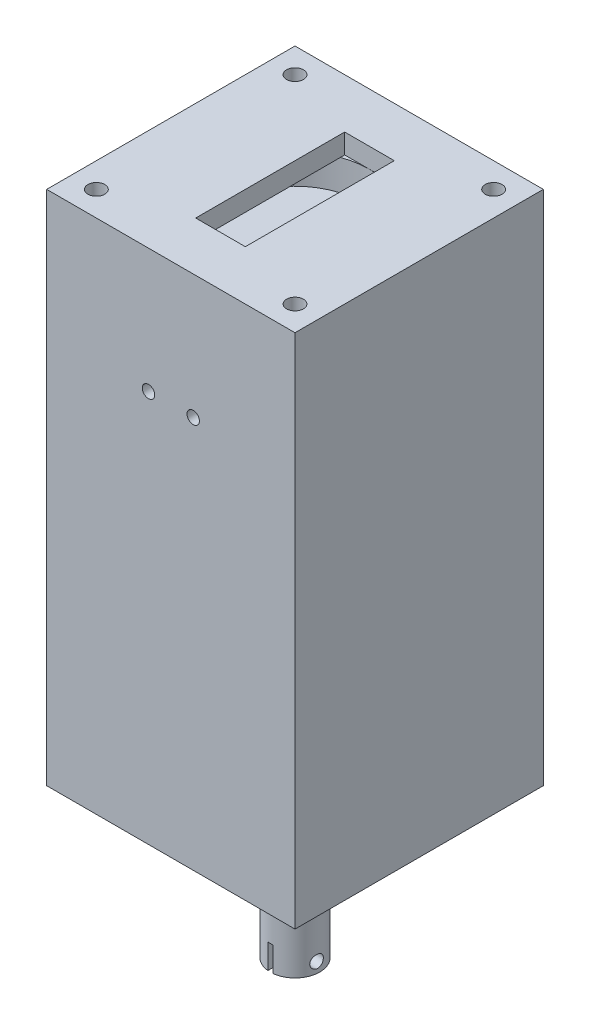
from build123d import *

# Parameters (mm, degrees)
SKETCH_1_W                         = 50
SKETCH_1_H                         = 50
EXTRUDE_1_DEPTH                    = 100
SKETCH_2_R                         = 15
CUT_EXTRUDE_1_DEPTH                = 80
EXTRUDE_START                      = 20
SKETCH_3_R                         = 15
EXTRUDE_2_DEPTH                    = 20
SKETCH_4_R                         = 5
CUT_EXTRUDE_3_DEPTH                = 107.066017178
SKETCH_13_R                        = 1
SKETCH_14_R                        = 13.5
EXTRUDE_4_DEPTH                    = 25
SKETCH_15_W                        = 50
SKETCH_15_H                        = 50
EXTRUDE_5_DEPTH                    = 4
HOLE_WIZARD_M3_1_AT_2_COUNT        = 2
HOLE_WIZARD_M3_1_AT_2_PITCH        = 40
HOLE_WIZARD_M3_1_AT_3_COUNT        = 2
HOLE_WIZARD_M3_1_AT_3_PITCH        = 40
HOLE_WIZARD_M3_1_AT_4_COUNT        = 2
HOLE_WIZARD_M3_1_AT_4_PITCH        = 56.568542495
SKETCH_17_W                        = 10
SKETCH_17_H                        = 30
CUT_EXTRUDE_4_DEPTH                = 4
EXTRUDE_START_2                    = 100
SKETCH_18_R                        = 5
EXTRUDE_6_DEPTH                    = 100
SKETCH_19_W                        = 1
SKETCH_19_H                        = 12
CUT_EXTRUDE_5_DEPTH                = 5
HOLE_WIZARD_M3_1_2_D               = 2.5
HOLE_WIZARD_M3_1_2_DEPTH           = 10
HOLE_WIZARD_M3_1_2_TIP             = 0.751075774
HOLE_WIZARD_M3_1_2_ON_FACE_2_D     = 2.5
HOLE_WIZARD_M3_1_2_ON_FACE_2_DEPTH = 10
HOLE_WIZARD_M3_1_2_ON_FACE_2_TIP   = 0.751075774
HOLE_WIZARD_M3_3_D                 = 2.5
HOLE_WIZARD_M3_3_DEPTH             = 4
HOLE_WIZARD_M3_3_TIP               = 0.751075774


with BuildPart() as part:
    # 草图1 → 凸台-拉伸1 (new body)
    with BuildSketch(Plane(origin=(0, 0, 0), x_dir=(1, 0, 0), z_dir=(0, 1, 0))):
        Rectangle(SKETCH_1_W, SKETCH_1_H)
    extrude(amount=EXTRUDE_1_DEPTH)

    # 草图2 → 切除-拉伸1 (cut)
    with BuildSketch(Plane(origin=(0, 100, 0), x_dir=(1, 0, 0), z_dir=(0, 1, 0))):
        with Locations(Location((0, 0, 0), (0, 0, 270))):
            Circle(SKETCH_2_R)
    extrude(amount=-CUT_EXTRUDE_1_DEPTH, mode=Mode.SUBTRACT)

    # 草图3 → 凸台-拉伸2 (add)
    with BuildSketch(Plane(origin=(0, 0, 0), x_dir=(1, 0, 0), z_dir=(0, 1, 0)).offset(EXTRUDE_START)):
        with Locations(Location((0, 0, 0), (0, 0, 270))):
            Circle(SKETCH_3_R)
    extrude(amount=-EXTRUDE_2_DEPTH)

    # 草图4 → 切除-拉伸3 (cut, through all)
    with BuildSketch(Plane(origin=(0, 0, 0), x_dir=(1, 0, 0), z_dir=(0, 1, 0))):
        with Locations(Location((0, 0, 0), (0, 0, 270))):
            Circle(SKETCH_4_R)
    extrude(amount=CUT_EXTRUDE_3_DEPTH, mode=Mode.SUBTRACT)

    # 扫描2: sweep along a curve in space
    with BuildLine() as sweep_2_path:
        add(Edge.make_bspline(
            [(-8.485281374, 20, -8.485281374), (-4.970562748, 20.75, -12), (0, 21.5, -12), (4.970562748, 22.25, -12), (8.485281374, 23, -8.485281374), (12, 23.75, -4.970562748), (12, 24.5, 0), (12, 25.25, 4.970562748), (8.485281374, 26, 8.485281374), (4.970562748, 26.75, 12), (0, 27.5, 12), (-4.970562748, 28.25, 12), (-8.485281374, 29, 8.485281374), (-12, 29.75, 4.970562748), (-12, 30.5, 0), (-12, 31.25, -4.970562748), (-8.485281374, 32, -8.485281374), (-4.970562748, 32.75, -12), (0, 33.5, -12), (4.970562748, 34.25, -12), (8.485281374, 35, -8.485281374), (12, 35.75, -4.970562748), (12, 36.5, 0), (12, 37.25, 4.970562748), (8.485281374, 38, 8.485281374), (4.970562748, 38.75, 12), (0, 39.5, 12), (-4.970562748, 40.25, 12), (-8.485281374, 41, 8.485281374), (-12, 41.75, 4.970562748), (-12, 42.5, 0), (-12, 43.25, -4.970562748), (-8.485281374, 44, -8.485281374), (-4.970562748, 44.75, -12), (0, 45.5, -12), (4.970562748, 46.25, -12), (8.485281374, 47, -8.485281374), (12, 47.75, -4.970562748), (12, 48.5, 0), (12, 49.25, 4.970562748), (8.485281374, 50, 8.485281374), (4.970562748, 50.75, 12), (0, 51.5, 12), (-4.970562748, 52.25, 12), (-8.485281374, 53, 8.485281374), (-12, 53.75, 4.970562748), (-12, 54.5, 0), (-12, 55.25, -4.970562748), (-8.485281374, 56, -8.485281374), (-4.970562748, 56.75, -12), (0, 57.5, -12), (4.970562748, 58.25, -12), (8.485281374, 59, -8.485281374), (12, 59.75, -4.970562748), (12, 60.5, 0), (12, 61.25, 4.970562748), (8.485281374, 62, 8.485281374), (4.970562748, 62.75, 12), (0, 63.5, 12), (-4.970562748, 64.25, 12), (-8.485281374, 65, 8.485281374), (-12, 65.75, 4.970562748), (-12, 66.5, 0), (-12, 67.25, -4.970562748), (-8.485281374, 68, -8.485281374)],
            knots=[0, 0, 0, 0.03125, 0.03125, 0.0625, 0.0625, 0.09375, 0.09375, 0.125, 0.125, 0.15625, 0.15625, 0.1875, 0.1875, 0.21875, 0.21875, 0.25, 0.25, 0.28125, 0.28125, 0.3125, 0.3125, 0.34375, 0.34375, 0.375, 0.375, 0.40625, 0.40625, 0.4375, 0.4375, 0.46875, 0.46875, 0.5, 0.5, 0.53125, 0.53125, 0.5625, 0.5625, 0.59375, 0.59375, 0.625, 0.625, 0.65625, 0.65625, 0.6875, 0.6875, 0.71875, 0.71875, 0.75, 0.75, 0.78125, 0.78125, 0.8125, 0.8125, 0.84375, 0.84375, 0.875, 0.875, 0.90625, 0.90625, 0.9375, 0.9375, 0.96875, 0.96875, 1, 1, 1], degree=2, weights=[1, 0.923879533, 1, 0.923879533, 1, 0.923879533, 1, 0.923879533, 1, 0.923879533, 1, 0.923879533, 1, 0.923879533, 1, 0.923879533, 1, 0.923879533, 1, 0.923879533, 1, 0.923879533, 1, 0.923879533, 1, 0.923879533, 1, 0.923879533, 1, 0.923879533, 1, 0.923879533, 1, 0.923879533, 1, 0.923879533, 1, 0.923879533, 1, 0.923879533, 1, 0.923879533, 1, 0.923879533, 1, 0.923879533, 1, 0.923879533, 1, 0.923879533, 1, 0.923879533, 1, 0.923879533, 1, 0.923879533, 1, 0.923879533, 1, 0.923879533, 1, 0.923879533, 1, 0.923879533, 1]))
    with BuildLine() as sweep_2_axis:
        Line((0, 20, 0), (0, 68, 0))
    # 草图13 → 扫描2 (sweep)
    with BuildSketch(Plane(origin=(-8.485281374, 20, -8.485281374), x_dir=(-0.7149337320752515, 0.14591437688938746, -0.6837973042926788), z_dir=(0.6991922187359872, 0.14919947224463495, -0.6991922187359996))):
        with Locations((-0.098478254, 0.090535561)):
            Circle(SKETCH_13_R)
    sweep(path=sweep_2_path.line, binormal=sweep_2_axis.edges()[0])

    # 草图15 → 凸台-拉伸5 (add)
    with BuildSketch(Plane(origin=(0, 100, 0), x_dir=(1, 0, 0), z_dir=(0, 1, 0))):
        Rectangle(SKETCH_15_W, SKETCH_15_H)
    extrude(amount=EXTRUDE_5_DEPTH)

    # 草图16 → Hole Wizard M3 _1 (revolve, cut)
    with BuildSketch(Plane(origin=(-20, 104, -20), x_dir=(0, 0, 1), z_dir=(1, 0, 0))):
        Polygon((0, 0), (0, 8.021463052), (1.7, 7), (1.7, 0), align=None)
    hole_wizard_m3_1 = revolve(axis=Axis((-20, 110.35, -20), (0, -1, 0)), mode=Mode.SUBTRACT)

    # Hole Wizard M3 _1 at 2: Hole Wizard M3 _1 ×2
    with Locations(*[(0, 0, i * HOLE_WIZARD_M3_1_AT_2_PITCH) for i in range(1, HOLE_WIZARD_M3_1_AT_2_COUNT)]):
        add(hole_wizard_m3_1, mode=Mode.SUBTRACT)

    # Hole Wizard M3 _1 at 3: Hole Wizard M3 _1 ×2
    with Locations(*[(i * HOLE_WIZARD_M3_1_AT_3_PITCH, 0, 0) for i in range(1, HOLE_WIZARD_M3_1_AT_3_COUNT)]):
        add(hole_wizard_m3_1, mode=Mode.SUBTRACT)

    # Hole Wizard M3 _1 at 4: Hole Wizard M3 _1 ×2
    with Locations(*[Vector(0.7071067811865476, 0, 0.7071067811865476) * (i * HOLE_WIZARD_M3_1_AT_4_PITCH) for i in range(1, HOLE_WIZARD_M3_1_AT_4_COUNT)]):
        add(hole_wizard_m3_1, mode=Mode.SUBTRACT)

    # 草图17 → 切除-拉伸4 (cut)
    with BuildSketch(Plane(origin=(0, 104, 0), x_dir=(1, 0, 0), z_dir=(0, 1, 0))):
        Rectangle(SKETCH_17_W, SKETCH_17_H)
    extrude(amount=-CUT_EXTRUDE_4_DEPTH, mode=Mode.SUBTRACT)



with BuildPart() as body_2:
    # 草图14 → 凸台-拉伸4 (new body)
    with BuildSketch(Plane(origin=(0, 70, 0), x_dir=(1, 0, 0), z_dir=(0, 1, 0))):
        with Locations(Location((0, 0, 0), (0, 0, 270))):
            Circle(SKETCH_14_R)
    extrude(amount=EXTRUDE_4_DEPTH)


with BuildPart() as part_1:
    add(part.part)

    add(body_2.part)  # 凸台-拉伸6 merges body 2
    # 草图18 → 凸台-拉伸6 (add)
    with BuildSketch(Plane.XZ.offset(-70).offset(EXTRUDE_START_2)):
        with Locations(Location((0, 0, 0), (0, 0, 90))):
            Circle(SKETCH_18_R)
    extrude(amount=-EXTRUDE_6_DEPTH)

    # 草图19 → 切除-拉伸5 (cut)
    with BuildSketch(Plane.XZ.offset(30)):
        Rectangle(SKETCH_19_W, SKETCH_19_H)
    extrude(amount=-CUT_EXTRUDE_5_DEPTH, mode=Mode.SUBTRACT)

    # Hole Wizard M3 _1 2
    with Locations(Plane(origin=(4.975049046, -27.906185432, 0.498885745), x_dir=(-0.09977714899, 0, 0.995009809268), z_dir=(0.995009809268, 0, 0.09977714899))):
        with Locations((0, 0)):
            Hole(HOLE_WIZARD_M3_1_2_D / 2, depth=HOLE_WIZARD_M3_1_2_DEPTH)
            with Locations((0, 0, -(HOLE_WIZARD_M3_1_2_DEPTH + HOLE_WIZARD_M3_1_2_TIP / 2))):  # 118° drill point
                Cone(0, HOLE_WIZARD_M3_1_2_D / 2, HOLE_WIZARD_M3_1_2_TIP, mode=Mode.SUBTRACT)

    # Hole Wizard M3 _1 2 on face 2
    with Locations(Plane(origin=(-40.916593055, -8.168608316, 0), x_dir=(-0.09977714899, 0, 0.995009809268), z_dir=(0.995009809268, 0, 0.09977714899))):
        with Locations((0, 0)):
            Hole(HOLE_WIZARD_M3_1_2_ON_FACE_2_D / 2, depth=HOLE_WIZARD_M3_1_2_ON_FACE_2_DEPTH)
            with Locations((0, 0, -(HOLE_WIZARD_M3_1_2_ON_FACE_2_DEPTH + HOLE_WIZARD_M3_1_2_ON_FACE_2_TIP / 2))):  # 118° drill point
                Cone(0, HOLE_WIZARD_M3_1_2_ON_FACE_2_D / 2, HOLE_WIZARD_M3_1_2_ON_FACE_2_TIP, mode=Mode.SUBTRACT)

    # M3 螺纹孔的螺纹孔钻头3
    with Locations(Plane(origin=(-4.5, 79, 25), x_dir=(1, 0, 0), z_dir=(0, 0, 1))):
        with Locations((0, 0), (8.999966813, -0.024441058)):
            Hole(HOLE_WIZARD_M3_3_D / 2, depth=HOLE_WIZARD_M3_3_DEPTH)
            with Locations((0, 0, -(HOLE_WIZARD_M3_3_DEPTH + HOLE_WIZARD_M3_3_TIP / 2))):  # 118° drill point
                Cone(0, HOLE_WIZARD_M3_3_D / 2, HOLE_WIZARD_M3_3_TIP, mode=Mode.SUBTRACT)


solid = part_1.part
